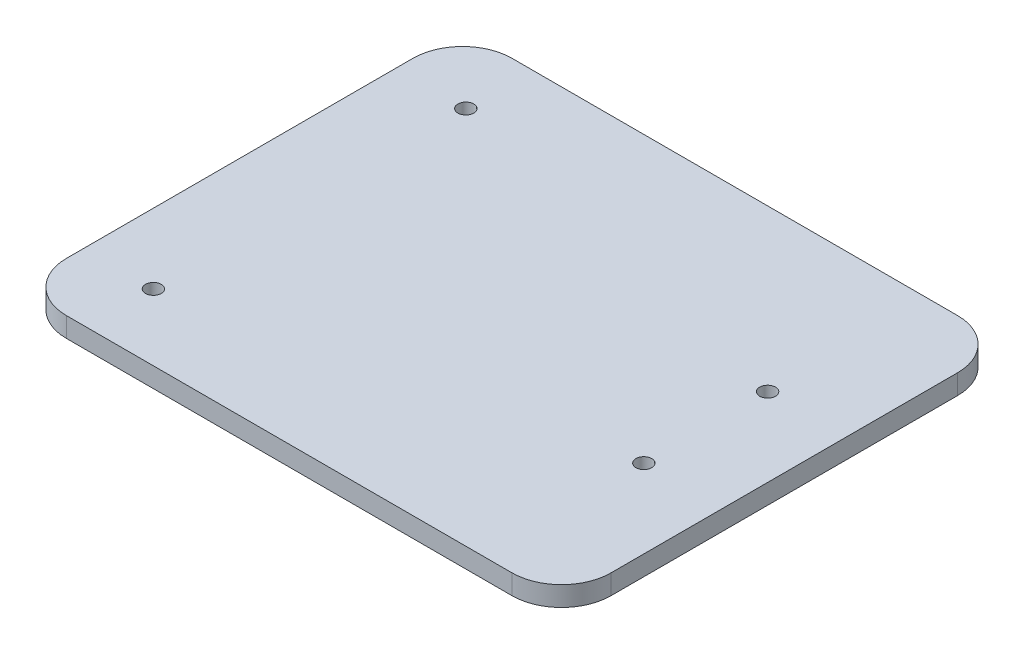
from build123d import *

# Parameters (mm, degrees)
SKETCH_1_W          = 110
SKETCH_1_H          = 90
EXTRUDE_1_DEPTH     = 4
FILLET_1_R          = 10
SKETCH_2_R          = 1.6
CUT_EXTRUDE_1_DEPTH = 4


with BuildPart() as part:
    # 草图1 → 凸台-拉伸1 (new body)
    with BuildSketch(Plane(origin=(0, 0, 0), x_dir=(1, 0, 0), z_dir=(0, 1, 0))):
        with Locations((17.30161478, -7.864857462)):
            Rectangle(SKETCH_1_W, SKETCH_1_H)
    extrude(amount=EXTRUDE_1_DEPTH)

    # 圆角1
    fillet_1_edges = [part.edges().sort_by_distance(p)[0] for p in [
        (-37.69838522, 2, -37.135142538),
        (72.30161478, 2, -37.135142538),
        (72.30161478, 2, 52.864857462),
        (-37.69838522, 2, 52.864857462),
    ]]
    fillet(fillet_1_edges, radius=FILLET_1_R)

    # 草图2 → 切除-拉伸1 (cut)
    with BuildSketch(Plane(origin=(0, 4, 0), x_dir=(1, 0, 0), z_dir=(0, 1, 0))):
        with Locations(Location((-23.573851483, 23.685142538, 0), (0, 0, 270))):
            Circle(SKETCH_2_R)
        with Locations(Location((-23.573851483, -39.414857462, 0), (0, 0, 270))):
            Circle(SKETCH_2_R)
        with Locations(Location((56.426148517, -20.364857462, 0), (0, 0, 270))):
            Circle(SKETCH_2_R)
        with Locations(Location((56.426148517, 4.635142538, 0), (0, 0, 270))):
            Circle(SKETCH_2_R)
    extrude(amount=-CUT_EXTRUDE_1_DEPTH, mode=Mode.SUBTRACT)


solid = part.part
